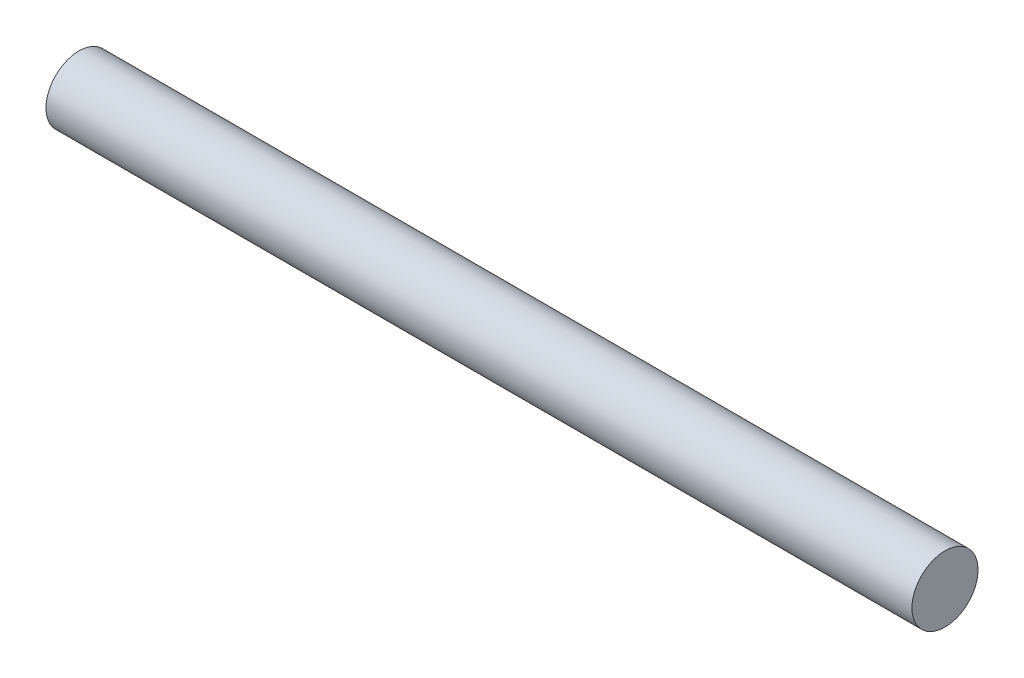
from build123d import *

# Parameters (mm, degrees)
SKETCH2_R           = 1.985
BOSS_EXTRUDE1_DEPTH = 52


with BuildPart() as part:
    # Sketch2 → Boss-Extrude1 (new body)
    with BuildSketch(Plane(origin=(0, 0, 0), x_dir=(0, 0, -1), z_dir=(1, 0, 0))):
        with Locations(Location((0, 0, 0), (0, 0, 180))):
            Circle(SKETCH2_R)
    extrude(amount=BOSS_EXTRUDE1_DEPTH)


solid = part.part
